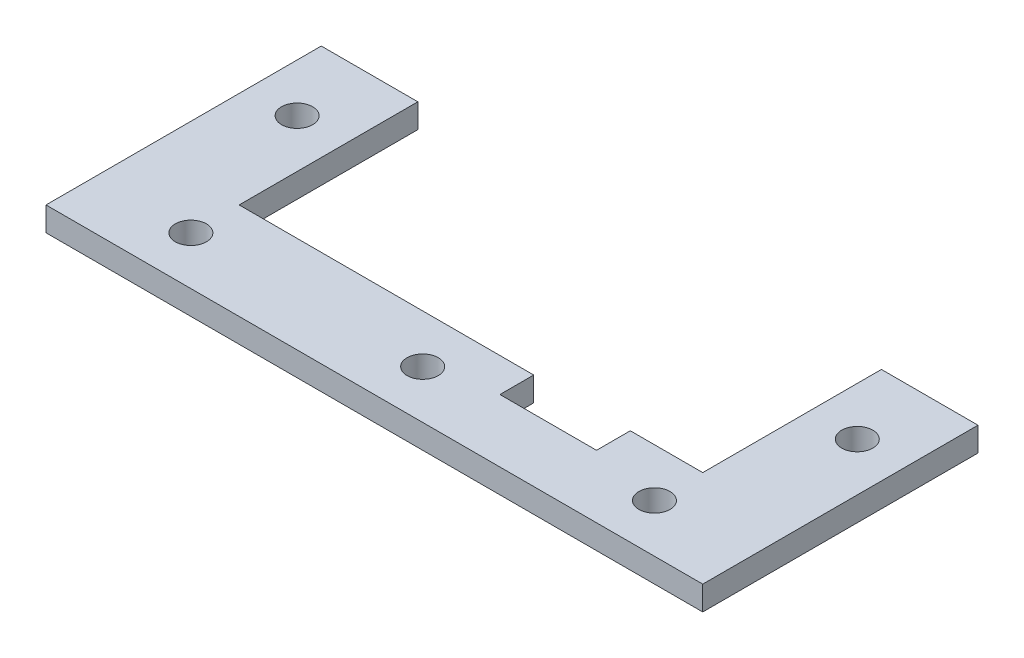
from build123d import *

# Parameters (mm, degrees)
BOSS_EXTRUDE1_DEPTH = 5
SKETCH3_W           = 20
SKETCH3_H           = 7
CUT_EXTRUDE1_DEPTH  = 130.344501236
SKETCH4_R           = 3.225
CUT_EXTRUDE2_DEPTH  = 130.344501236


with BuildPart() as part:
    # Sketch2 → Boss-Extrude1 (new body)
    with BuildSketch(Plane(origin=(0, 0, 0), x_dir=(1, 0, 0), z_dir=(0, 1, 0))):
        Polygon((0, 0), (-20, 0), (-20, -57), (116, -57), (116, 0), (96, 0), (96, -37), (0, -37), align=None)
    extrude(amount=BOSS_EXTRUDE1_DEPTH)

    # Sketch3 → Cut-Extrude1 (cut, through all)
    with BuildSketch(Plane(origin=(0, 5, 0), x_dir=(1, 0, 0), z_dir=(0, 1, 0))):
        with Locations((71, -40.5)):
            Rectangle(SKETCH3_W, SKETCH3_H)
    extrude(amount=-CUT_EXTRUDE1_DEPTH, mode=Mode.SUBTRACT)

    # Sketch4 → Cut-Extrude2 (cut, through all)
    with BuildSketch(Plane(origin=(0, 5, 0), x_dir=(1, 0, 0), z_dir=(0, 1, 0))):
        with Locations(Location((-10, -15, 0), (0, 0, 270))):
            Circle(SKETCH4_R)
        with Locations(Location((0, -47, 0), (0, 0, 270))):
            Circle(SKETCH4_R)
        with Locations(Location((48, -47, 0), (0, 0, 270))):
            Circle(SKETCH4_R)
        with Locations(Location((96, -47, 0), (0, 0, 270))):
            Circle(SKETCH4_R)
        with Locations(Location((106, -15, 0), (0, 0, 270))):
            Circle(SKETCH4_R)
    extrude(amount=-CUT_EXTRUDE2_DEPTH, mode=Mode.SUBTRACT)


solid = part.part
